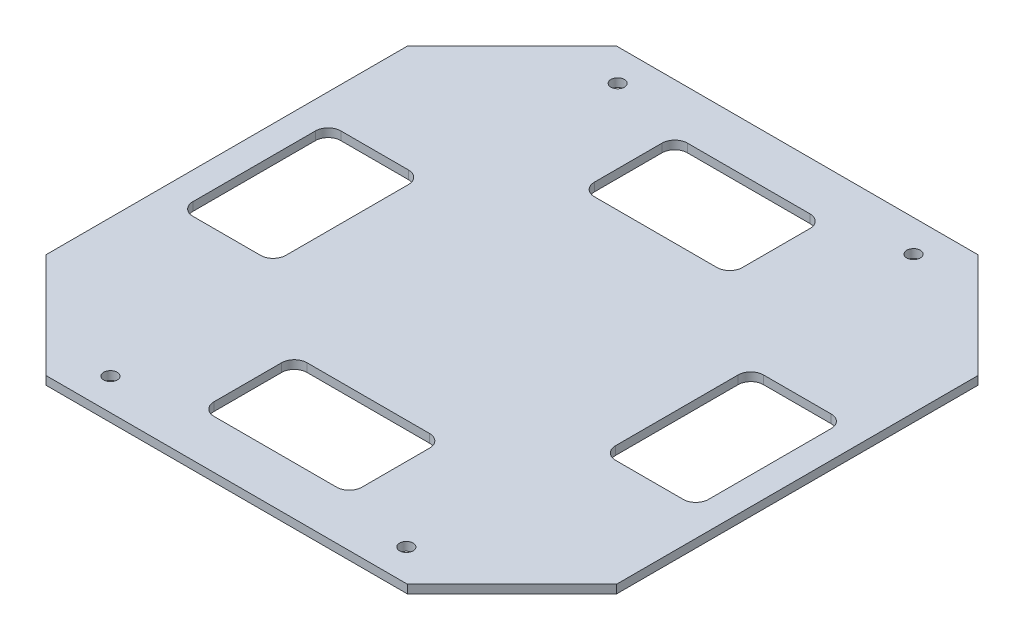
from build123d import *

# Parameters (mm, degrees)
BOSS_EXTRUDE1_DEPTH  = 2
M3_CLEARANCE_HOLE1_D = 3.2
SKETCH4_W            = 35
SKETCH4_H            = 22
SKETCH4_W_2          = 22
SKETCH4_H_2          = 35
CUT_EXTRUDE1_DEPTH   = 96.480364474
FILLET1_R            = 3


with BuildPart() as part:
    # Sketch1 → Boss-Extrude1 (new body)
    with BuildSketch(Plane(origin=(0, 0, 0), x_dir=(1, 0, 0), z_dir=(0, 1, 0))):
        Polygon((-42.751262658, 67.5), (-67.5, 42.751262658), (-67.5, -42.751262658), (-42.751262658, -67.5), (42.751262658, -67.5), (67.5, -42.751262658), (67.5, 42.751262658), (42.751262658, 67.5), align=None)
    extrude(amount=BOSS_EXTRUDE1_DEPTH)

    # M3 Clearance Hole1 (through all)
    with Locations(Plane(origin=(0, 2, 0), x_dir=(1, 0, 0), z_dir=(0, 1, 0))):
        with Locations((-35, 60), (35, -60), (35, 60), (-35, -60)):
            Hole(M3_CLEARANCE_HOLE1_D / 2)

    # Sketch4 → Cut-Extrude1 (cut, through all)
    with BuildSketch(Plane(origin=(0, 2, 0), x_dir=(1, 0, 0), z_dir=(0, 1, 0))):
        with Locations((0, 45)):
            Rectangle(SKETCH4_W, SKETCH4_H)
        with Locations((-50, 0)):
            Rectangle(SKETCH4_W_2, SKETCH4_H_2)
        with Locations((50, 0)):
            Rectangle(SKETCH4_W_2, SKETCH4_H_2)
        with Locations((0, -45)):
            Rectangle(SKETCH4_W, SKETCH4_H)
    extrude(amount=-CUT_EXTRUDE1_DEPTH, mode=Mode.SUBTRACT)

    # Fillet1
    fillet1_edges = [part.edges().sort_by_distance(p)[0] for p in [
        (-17.5, 1, -34),
        (-17.5, 1, -56),
        (17.5, 1, -56),
        (17.5, 1, -34),
        (-39, 1, -17.5),
        (-39, 1, 17.5),
        (-61, 1, 17.5),
        (-61, 1, -17.5),
        (61, 1, -17.5),
        (61, 1, 17.5),
        (39, 1, 17.5),
        (39, 1, -17.5),
        (17.5, 1, 34),
        (17.5, 1, 56),
        (-17.5, 1, 56),
        (-17.5, 1, 34),
    ]]
    fillet(fillet1_edges, radius=FILLET1_R)


solid = part.part
